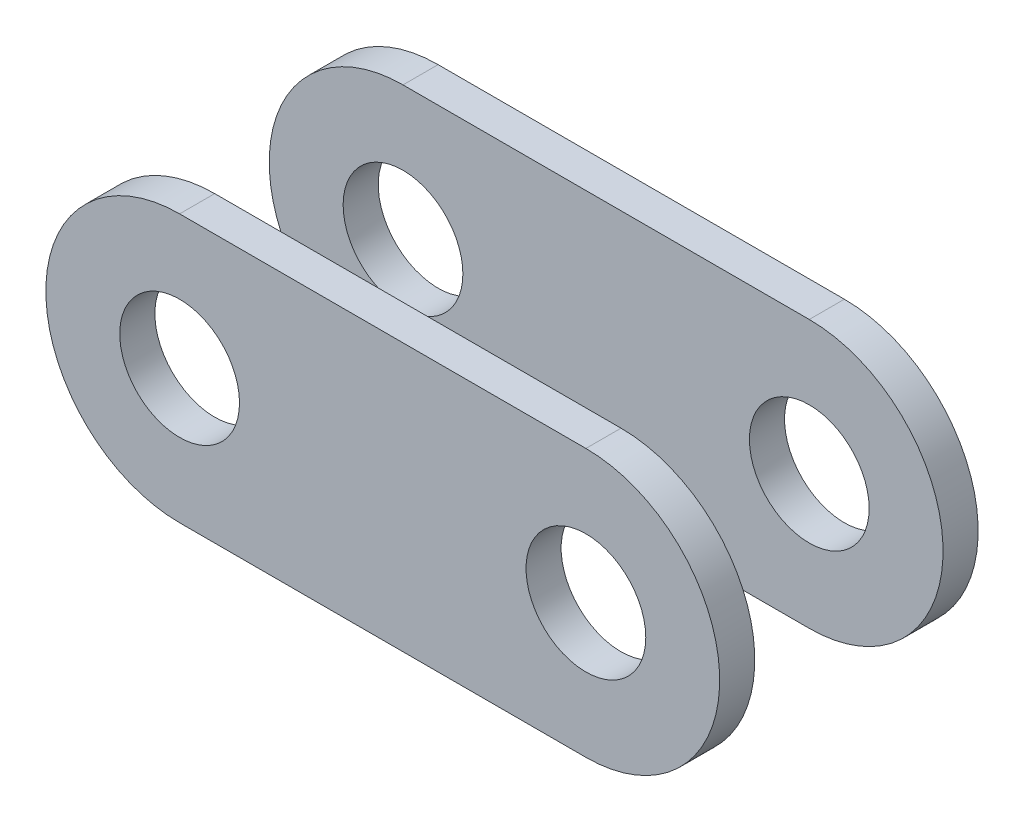
from build123d import *

# Parameters (mm, degrees)
BOSS_EXTRUDE1_DEPTH      = 3.9751
BOSS_EXTRUDE1_DEPTH_BACK = 3.9751
SKETCH2_R                = 1.8415
SKETCH3_W                = 20.7264
SKETCH3_H                = 5.7912
CUT_EXTRUDE1_DEPTH       = 17.369503444


with BuildPart() as part:
    # Sketch2 → Boss-Extrude1 (new, two sides: drawn at the far end of the back side and taken through both)
    with BuildSketch(Plane.XY.offset(-BOSS_EXTRUDE1_DEPTH_BACK)):
        with BuildLine():
            Line((-9.465807749, 4.1148), (3.030992251, 4.1148))
            ThreePointArc((3.030992251, 4.1148), (7.145792251, 0), (3.030992251, -4.1148))
            Line((3.030992251, -4.1148), (-9.465807749, -4.1148))
            ThreePointArc((-9.465807749, -4.1148), (-13.580607749, 0), (-9.465807749, 4.1148))
        make_face()
        with Locations((-9.465807749, 0)):
            Circle(SKETCH2_R, mode=Mode.SUBTRACT)
        with Locations((3.030992251, 0)):
            Circle(SKETCH2_R, mode=Mode.SUBTRACT)
    extrude(amount=BOSS_EXTRUDE1_DEPTH + BOSS_EXTRUDE1_DEPTH_BACK)

    # Sketch3 → Cut-Extrude1 (cut, through all)
    with BuildSketch(Plane(origin=(0, 4.1148, 0), x_dir=(1, 0, 0), z_dir=(0, 1, 0))):
        with Locations((-3.217407749, 0)):
            Rectangle(SKETCH3_W, SKETCH3_H)
    extrude(amount=-CUT_EXTRUDE1_DEPTH, mode=Mode.SUBTRACT)


with BuildPart() as cut_extrude1_piece_1:
    # of the separate pieces the step leaves, piece 1, a body of its own (cut_extrude1_pieces)
    add(part.part.solids().sort_by_distance((3.030992251, -4.1148, 2.8956))[0])


with BuildPart() as cut_extrude1_piece_2:
    # of the separate pieces the step leaves, piece 2, a body of its own (cut_extrude1_pieces)
    add(part.part.solids().sort_by_distance((3.030992251, -4.1148, -3.9751))[0])


solid = Compound([cut_extrude1_piece_1.part, cut_extrude1_piece_2.part])
